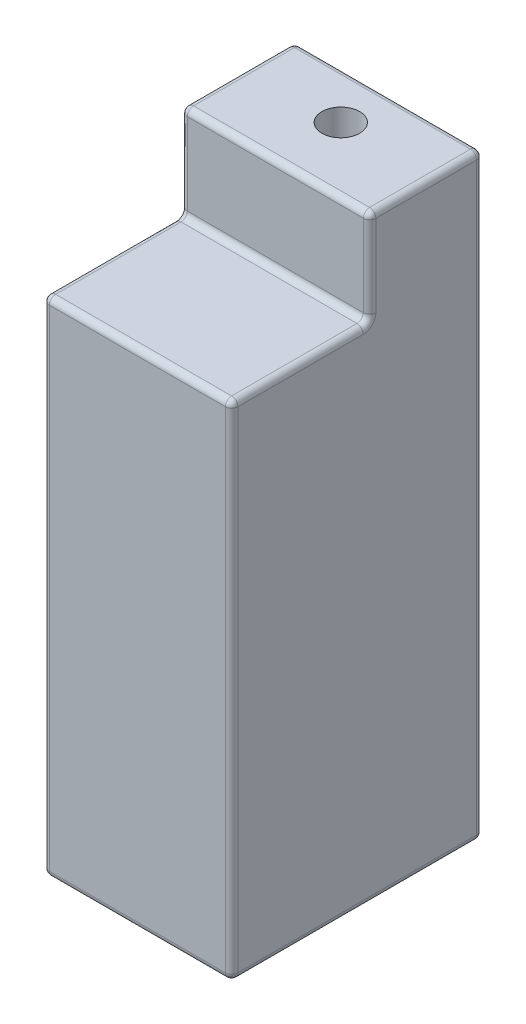
from build123d import *

# Parameters (mm, degrees)
SKETCH1_W           = 300
SKETCH1_H           = 800
BOSS_EXTRUDE1_DEPTH = 400
SKETCH3_W           = 300
SKETCH3_H           = 180.426730866
BOSS_EXTRUDE4_DEPTH = 150
FILLET6_R           = 10
SKETCH4_R           = 30
CUT_EXTRUDE1_DEPTH  = 150
SKETCH7_W           = 251.42002043
SKETCH7_H           = 445.81306925
CUT_EXTRUDE5_DEPTH  = 170
SKETCH8_R           = 40
CUT_EXTRUDE6_DEPTH  = 80
FILLET8_R           = 10


with BuildPart() as part:
    # Sketch1 → Boss-Extrude1 (new body)
    with BuildSketch(Plane.XY):
        Rectangle(SKETCH1_W, SKETCH1_H)
    extrude(amount=BOSS_EXTRUDE1_DEPTH)

    # Sketch3 → Boss-Extrude4 (add)
    with BuildSketch(Plane(origin=(0, 400, 0), x_dir=(1, 0, 0), z_dir=(0, 1, 0))):
        with Locations((0, -90.213365433)):
            Rectangle(SKETCH3_W, SKETCH3_H)
    extrude(amount=BOSS_EXTRUDE4_DEPTH)

    # Fillet6
    fillet6_edges = [part.edges().sort_by_distance(p)[0] for p in [
        (-150, 0, 400),
        (0, -400, 400),
        (0, 400, 180.426730866),
        (-150, 475, 180.426730866),
        (150, 475, 180.426730866),
        (-150, 550, 90.213365433),
        (0, 550, 180.426730866),
        (150, 550, 90.213365433),
        (0, 550, 0),
        (150, 0, 400),
        (0, -400, 0),
        (-150, 75, 0),
        (150, 75, 0),
        (0, 400, 400),
        (150, -400, 200),
        (-150, -400, 200),
        (-150, 400, 290.213365433),
        (150, 400, 290.213365433),
    ]]
    fillet(fillet6_edges, radius=FILLET6_R)

    # Sketch4 → Cut-Extrude1 (cut)
    with BuildSketch(Plane(origin=(0, 550, 0), x_dir=(1, 0, 0), z_dir=(0, 1, 0))):
        with Locations(Location((0, -76.219748714, 0), (0, 0, 270))):
            Circle(SKETCH4_R)
    extrude(amount=-CUT_EXTRUDE1_DEPTH, mode=Mode.SUBTRACT)

    # Sketch7 → Cut-Extrude5 (cut)
    with BuildSketch(Plane(origin=(0, 0, 0), x_dir=(-1, 0, 0), z_dir=(0, 0, -1))):
        Rectangle(SKETCH7_W, SKETCH7_H)
    extrude(amount=-CUT_EXTRUDE5_DEPTH, mode=Mode.SUBTRACT)

    # Sketch8 → Cut-Extrude6 (cut)
    with BuildSketch(Plane.XZ.offset(400)):
        with Locations(Location((0, 200, 0), (0, 0, 270))):
            Circle(SKETCH8_R)
    extrude(amount=-CUT_EXTRUDE6_DEPTH, mode=Mode.SUBTRACT)

    # Fillet8
    fillet8_edges = [part.edges().sort_by_distance(p)[0] for p in [
        (-125.710010215, 0, 0),
        (0, 222.906534625, 0),
        (125.710010215, 0, 0),
        (0, -222.906534625, 0),
    ]]
    fillet(fillet8_edges, radius=FILLET8_R)


solid = part.part
